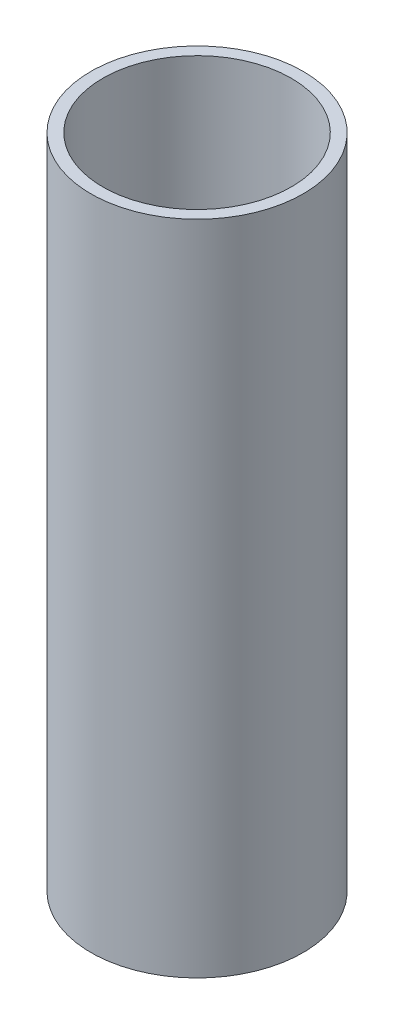
from build123d import *

# Parameters (mm, degrees)
SKETCH1_R           = 7.9375
SKETCH1_R_2         = 7.0485
BOSS_EXTRUDE1_DEPTH = 49.14


with BuildPart() as part:
    # Sketch1 → Boss-Extrude1 (new body)
    with BuildSketch(Plane(origin=(0, 0, 0), x_dir=(1, 0, 0), z_dir=(0, 1, 0))):
        with Locations(Location((13.632659162, 6.079429086, 0), (0, 0, 90))):
            Circle(SKETCH1_R)
        with Locations(Location((13.632659162, 6.079429086, 0), (0, 0, 90))):
            Circle(SKETCH1_R_2, mode=Mode.SUBTRACT)
    extrude(amount=BOSS_EXTRUDE1_DEPTH)


solid = part.part
